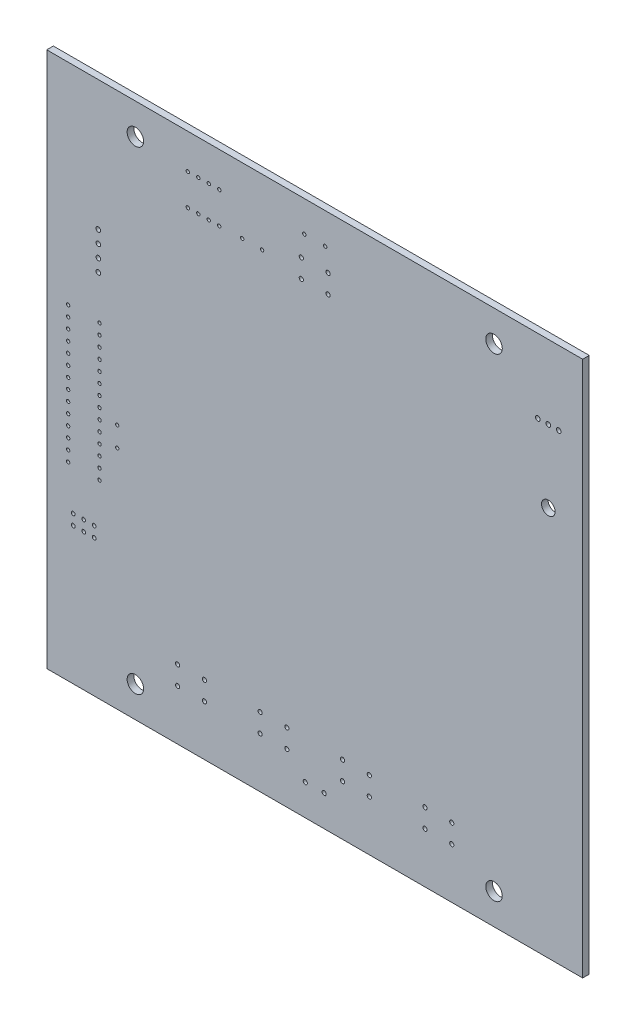
from build123d import *

# Parameters (mm, degrees)
SKIZZE1_W           = 130
SKIZZE1_H           = 130
BOARD_OUTLINE_DEPTH = 1.6
SKIZZE2_R           = 2
SKIZZE2_R_2         = 1.651
NPTH_DEPTH          = 188.390127808
SKIZZE3_R           = 0.405
SKIZZE3_R_2         = 0.56
SKIZZE3_R_3         = 0.51
SKIZZE3_R_4         = 0.455
PTH_DEPTH           = 188.390127808


with BuildPart() as part:
    # Skizze1 → Board_Outline (new body)
    with BuildSketch(Plane.XY):
        with Locations((67.5, 67.5)):
            Rectangle(SKIZZE1_W, SKIZZE1_H)
    extrude(amount=BOARD_OUTLINE_DEPTH)

    # Skizze2 → NPTH (cut, through all)
    with BuildSketch(Plane.XY):
        with Locations((24, 125)):
            Circle(SKIZZE2_R)
        with Locations((111, 10)):
            Circle(SKIZZE2_R)
        with Locations((24, 10)):
            Circle(SKIZZE2_R)
        with Locations((111, 125)):
            Circle(SKIZZE2_R)
        with Locations((124.17, 97.094)):
            Circle(SKIZZE2_R_2)
    extrude(amount=NPTH_DEPTH, mode=Mode.SUBTRACT)

    # Skizze3 → PTH (cut, through all)
    with BuildSketch(Plane.XY):
        with Locations((15.31, 81.51)):
            Circle(SKIZZE3_R)
        with Locations((15.31, 78.97)):
            Circle(SKIZZE3_R)
        with Locations((15.31, 76.43)):
            Circle(SKIZZE3_R)
        with Locations((15.31, 73.89)):
            Circle(SKIZZE3_R)
        with Locations((15.31, 71.35)):
            Circle(SKIZZE3_R)
        with Locations((15.31, 68.81)):
            Circle(SKIZZE3_R)
        with Locations((15.31, 66.27)):
            Circle(SKIZZE3_R)
        with Locations((15.31, 63.73)):
            Circle(SKIZZE3_R)
        with Locations((15.31, 61.19)):
            Circle(SKIZZE3_R)
        with Locations((15.31, 58.65)):
            Circle(SKIZZE3_R)
        with Locations((15.31, 56.11)):
            Circle(SKIZZE3_R)
        with Locations((15.31, 53.57)):
            Circle(SKIZZE3_R)
        with Locations((15.31, 51.03)):
            Circle(SKIZZE3_R)
        with Locations((15.31, 48.49)):
            Circle(SKIZZE3_R)
        with Locations((7.69, 48.49)):
            Circle(SKIZZE3_R)
        with Locations((7.69, 51.03)):
            Circle(SKIZZE3_R)
        with Locations((7.69, 53.57)):
            Circle(SKIZZE3_R)
        with Locations((7.69, 56.11)):
            Circle(SKIZZE3_R)
        with Locations((7.69, 58.65)):
            Circle(SKIZZE3_R)
        with Locations((7.69, 61.19)):
            Circle(SKIZZE3_R)
        with Locations((7.69, 63.73)):
            Circle(SKIZZE3_R)
        with Locations((7.69, 66.27)):
            Circle(SKIZZE3_R)
        with Locations((7.69, 68.81)):
            Circle(SKIZZE3_R)
        with Locations((7.69, 71.35)):
            Circle(SKIZZE3_R)
        with Locations((7.69, 73.89)):
            Circle(SKIZZE3_R)
        with Locations((7.69, 76.43)):
            Circle(SKIZZE3_R)
        with Locations((7.69, 78.97)):
            Circle(SKIZZE3_R)
        with Locations((7.69, 81.51)):
            Circle(SKIZZE3_R)
        with Locations((64.96, 125)):
            Circle(SKIZZE3_R)
        with Locations((70.04, 125)):
            Circle(SKIZZE3_R)
        with Locations((15.01, 92)):
            Circle(SKIZZE3_R_2)
        with Locations((15, 101)):
            Circle(SKIZZE3_R_2)
        with Locations((15.02, 95)):
            Circle(SKIZZE3_R_2)
        with Locations((15.01, 98.01)):
            Circle(SKIZZE3_R_2)
        with Locations((19.59, 62.2)):
            Circle(SKIZZE3_R)
        with Locations((19.59, 57.38)):
            Circle(SKIZZE3_R)
        with Locations((121.63, 114.62)):
            Circle(SKIZZE3_R_2)
        with Locations((124.17, 114.62)):
            Circle(SKIZZE3_R_2)
        with Locations((126.71, 114.62)):
            Circle(SKIZZE3_R_2)
        with Locations((54.74, 116.59)):
            Circle(SKIZZE3_R)
        with Locations((49.92, 116.59)):
            Circle(SKIZZE3_R)
        with Locations((44.34, 116.42)):
            Circle(SKIZZE3_R)
        with Locations((41.8, 116.42)):
            Circle(SKIZZE3_R)
        with Locations((39.26, 116.42)):
            Circle(SKIZZE3_R)
        with Locations((36.72, 116.42)):
            Circle(SKIZZE3_R)
        with Locations((36.72, 124.04)):
            Circle(SKIZZE3_R)
        with Locations((39.26, 124.04)):
            Circle(SKIZZE3_R)
        with Locations((41.8, 124.04)):
            Circle(SKIZZE3_R)
        with Locations((44.34, 124.04)):
            Circle(SKIZZE3_R)
        with Locations((70.75, 119.76)):
            Circle(SKIZZE3_R_3)
        with Locations((64.25, 119.76)):
            Circle(SKIZZE3_R_3)
        with Locations((70.75, 115.24)):
            Circle(SKIZZE3_R_3)
        with Locations((64.25, 115.24)):
            Circle(SKIZZE3_R_3)
        with Locations((34.25, 14.74)):
            Circle(SKIZZE3_R_3)
        with Locations((40.75, 14.74)):
            Circle(SKIZZE3_R_3)
        with Locations((34.25, 19.26)):
            Circle(SKIZZE3_R_3)
        with Locations((40.75, 19.26)):
            Circle(SKIZZE3_R_3)
        with Locations((54.25, 14.74)):
            Circle(SKIZZE3_R_3)
        with Locations((60.75, 14.74)):
            Circle(SKIZZE3_R_3)
        with Locations((54.25, 19.26)):
            Circle(SKIZZE3_R_3)
        with Locations((60.75, 19.26)):
            Circle(SKIZZE3_R_3)
        with Locations((74.25, 14.74)):
            Circle(SKIZZE3_R_3)
        with Locations((80.75, 14.74)):
            Circle(SKIZZE3_R_3)
        with Locations((74.25, 19.26)):
            Circle(SKIZZE3_R_3)
        with Locations((80.75, 19.26)):
            Circle(SKIZZE3_R_3)
        with Locations((94.25, 14.74)):
            Circle(SKIZZE3_R_3)
        with Locations((100.75, 14.74)):
            Circle(SKIZZE3_R_3)
        with Locations((94.25, 19.26)):
            Circle(SKIZZE3_R_3)
        with Locations((100.75, 19.26)):
            Circle(SKIZZE3_R_3)
        with Locations((65.21, 10)):
            Circle(SKIZZE3_R_3)
        with Locations((69.79, 10)):
            Circle(SKIZZE3_R_3)
        with Locations((8.92, 38.29)):
            Circle(SKIZZE3_R_4)
        with Locations((8.92, 35.75)):
            Circle(SKIZZE3_R_4)
        with Locations((11.46, 38.29)):
            Circle(SKIZZE3_R_4)
        with Locations((11.46, 35.75)):
            Circle(SKIZZE3_R_4)
        with Locations((14, 38.29)):
            Circle(SKIZZE3_R_4)
        with Locations((14, 35.75)):
            Circle(SKIZZE3_R_4)
    extrude(amount=PTH_DEPTH, mode=Mode.SUBTRACT)


solid = part.part
